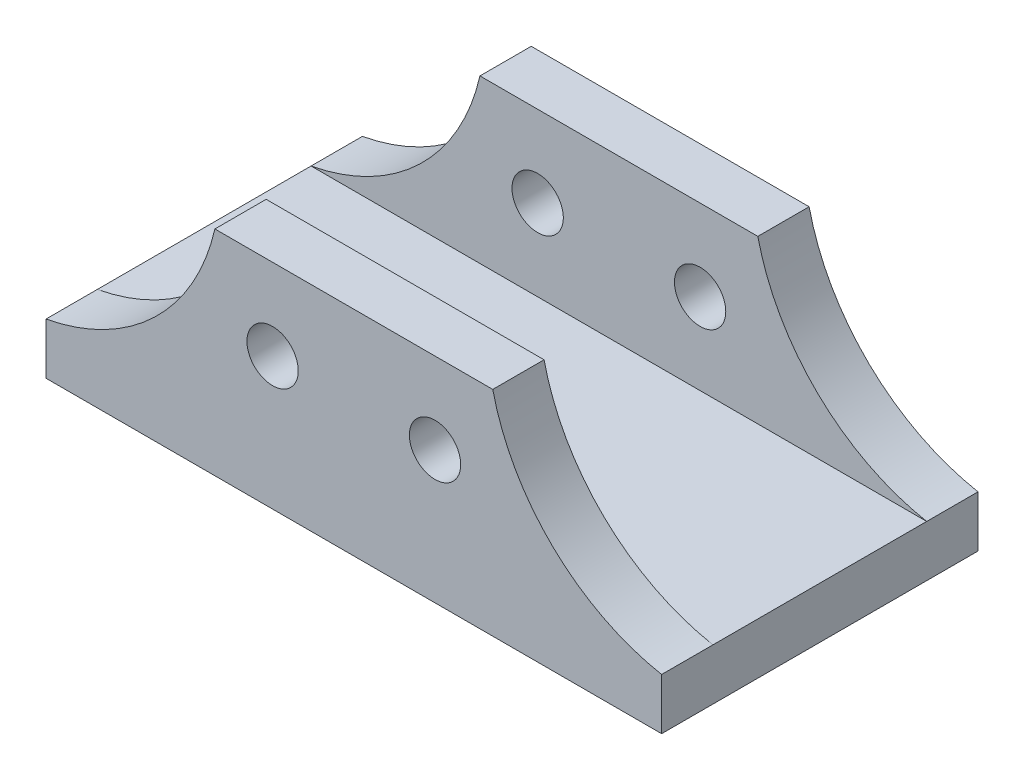
from build123d import *

# Parameters (mm, degrees)
SKETCH1_R           = 6
BOSS_EXTRUDE1_DEPTH = 12
BOSS_EXTRUDE2_START = -25
SKETCH2_W           = 144
SKETCH2_H           = 12
BOSS_EXTRUDE2_DEPTH = 50


with BuildPart() as part:
    # Sketch1 → Boss-Extrude1 (new body)
    with BuildSketch(Plane.XY):
        with BuildLine():
            Line((-72, 0), (72, 0))
            Line((72, 0), (72, 12))
            ThreePointArc((72, 12), (46.579087682, 25.10523588), (32.5, 50))
            Line((32.5, 50), (-32.5, 50))
            ThreePointArc((-32.5, 50), (-46.579087682, 25.10523588), (-72, 12))
            Line((-72, 12), (-72, 0))
        make_face()
        with Locations((19, 31)):
            Circle(SKETCH1_R, mode=Mode.SUBTRACT)
        with Locations(Location((-19, 31, 0), (0, 0, 180))):
            Circle(SKETCH1_R, mode=Mode.SUBTRACT)
    extrude(amount=BOSS_EXTRUDE1_DEPTH)


with BuildPart() as body_2:
    # Mirror2: mirrored copy
    add(part.part.mirror(Plane.XY.offset(37)))


with BuildPart() as part_1:
    add(part.part)

    add(body_2.part)  # Boss-Extrude2 merges body 2
    # Sketch2 → Boss-Extrude2 (add)
    with BuildSketch(Plane.XY.offset(37).offset(BOSS_EXTRUDE2_START)):
        with Locations((0, 6)):
            Rectangle(SKETCH2_W, SKETCH2_H)
    extrude(amount=BOSS_EXTRUDE2_DEPTH)


solid = part_1.part
